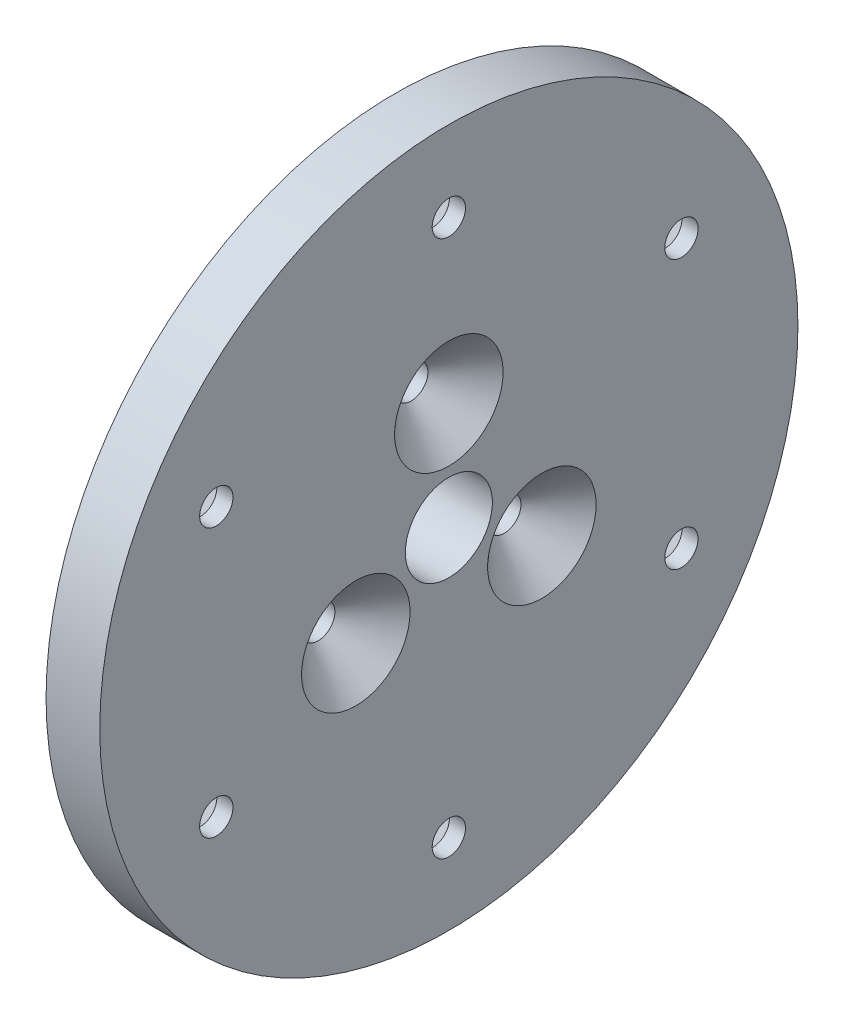
from build123d import *

# Parameters (mm, degrees)
F_8_1_8_1_DURCHMESSER_BOHRUNG1_D = 8.1
SKIZZE4_R                        = 1.55
SCHNITT_LINEAR_AUSTRAGEN1_DEPTH  = 47.652974182
FASE1_SIZE                       = 3.5
SKIZZE5_R                        = 1.55
SCHNITT_LINEAR_AUSTRAGEN2_DEPTH  = 47.652974182
FASE2_SIZE                       = 3.5


with BuildPart() as part:
    # Skizze1 → Rotation1 (revolve)
    with BuildSketch(Plane.XY, mode=Mode.PRIVATE) as rotation1_sk:
        Polygon((0, 0), (0, 16.5), (3, 16.5), (3, 32.5), (8, 32.5), (8, 0), align=None)
    revolve(rotation1_sk.sketch.rotate(Axis((0, 0, 0), (-1, 0, 0)), 90), axis=Axis((0, 0, 0), (-1, 0, 0)))

    # Ø8.1 (8.1) Durchmesser Bohrung1 (through all)
    with Locations(Plane.ZY):
        with Locations((0, 0)):
            Hole(F_8_1_8_1_DURCHMESSER_BOHRUNG1_D / 2)

    # Skizze4 → Schnitt-Linear austragen1 (cut, through all)
    with BuildSketch(Plane(origin=(8, 0, 0), x_dir=(0, 0, -1), z_dir=(1, 0, 0))):
        with Locations((0, 10)):
            Circle(SKIZZE4_R)
        with Locations((8.660254038, -5)):
            Circle(SKIZZE4_R)
        with Locations((-8.660254038, -5)):
            Circle(SKIZZE4_R)
    extrude(amount=-SCHNITT_LINEAR_AUSTRAGEN1_DEPTH, mode=Mode.SUBTRACT)

    # Fase1
    fase1_edges = [part.edges().sort_by_distance(p)[0] for p in [
        (8, 10, 1.55),
        (8, -5, -7.110254038),
        (8, -5, 10.210254038),
    ]]
    chamfer(fase1_edges, length=FASE1_SIZE)

    # Skizze5 → Schnitt-Linear austragen2 (cut, through all)
    with BuildSketch(Plane(origin=(8, 0, 0), x_dir=(0, 0, -1), z_dir=(1, 0, 0))):
        with Locations((0, 25)):
            Circle(SKIZZE5_R)
        with Locations((21.650635095, 12.5)):
            Circle(SKIZZE5_R)
        with Locations((21.650635095, -12.5)):
            Circle(SKIZZE5_R)
        with Locations((0, -25)):
            Circle(SKIZZE5_R)
        with Locations((-21.650635095, -12.5)):
            Circle(SKIZZE5_R)
        with Locations((-21.650635095, 12.5)):
            Circle(SKIZZE5_R)
    extrude(amount=-SCHNITT_LINEAR_AUSTRAGEN2_DEPTH, mode=Mode.SUBTRACT)

    # Fase2
    fase2_edges = [part.edges().sort_by_distance(p)[0] for p in [
        (3, 25, 1.55),
        (3, 12.5, 23.200635095),
        (3, -12.5, 23.200635095),
        (3, -25, 1.55),
        (3, -12.5, -20.100635095),
        (3, 12.5, -20.100635095),
    ]]
    chamfer(fase2_edges, length=FASE2_SIZE)


solid = part.part
